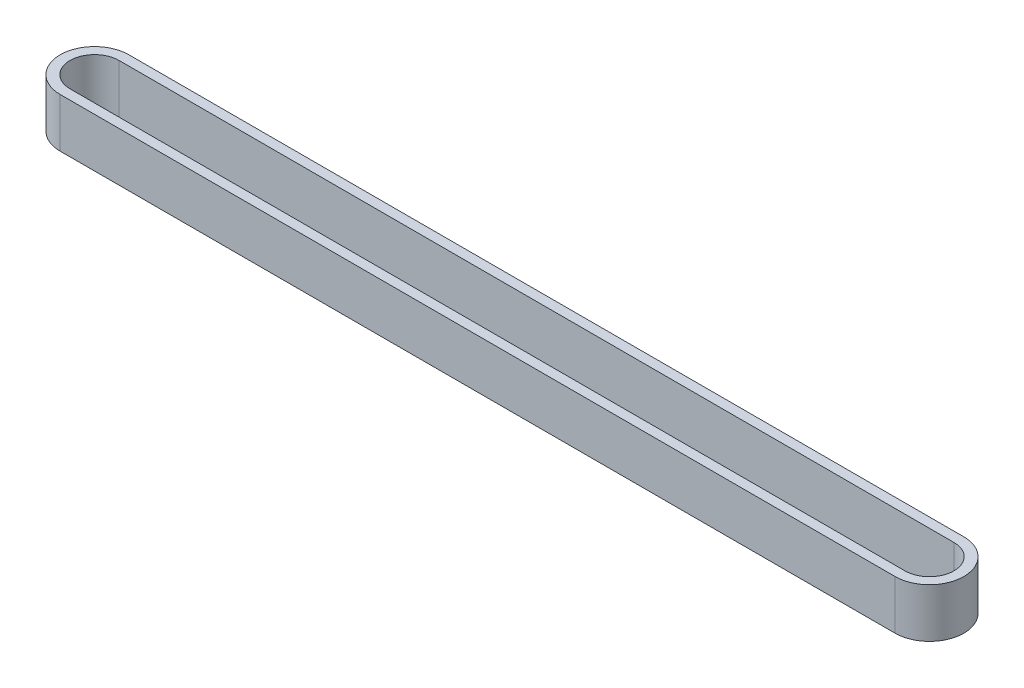
from build123d import *

# Parameters (mm, degrees)
EXTRUDE_1_DEPTH = 10


with BuildPart() as part:
    # 草图1 → 凸台-拉伸1 (new body)
    with BuildSketch(Plane(origin=(0, 0, 0), x_dir=(1, 0, 0), z_dir=(0, 1, 0))):
        with BuildLine():
            Line((0, -7), (-170, -7))
            ThreePointArc((-170, -7), (-177, 0), (-170, 7))
            Line((-170, 7), (0, 7))
            ThreePointArc((0, 7), (7, 0), (0, -7))
        make_face()
        with BuildLine():
            Line((0, -5), (-170, -5))
            ThreePointArc((-170, -5), (-175, 0), (-170, 5))
            Line((-170, 5), (0, 5))
            ThreePointArc((0, 5), (5, 0), (0, -5))
        make_face(mode=Mode.SUBTRACT)
    extrude(amount=EXTRUDE_1_DEPTH)


solid = part.part
